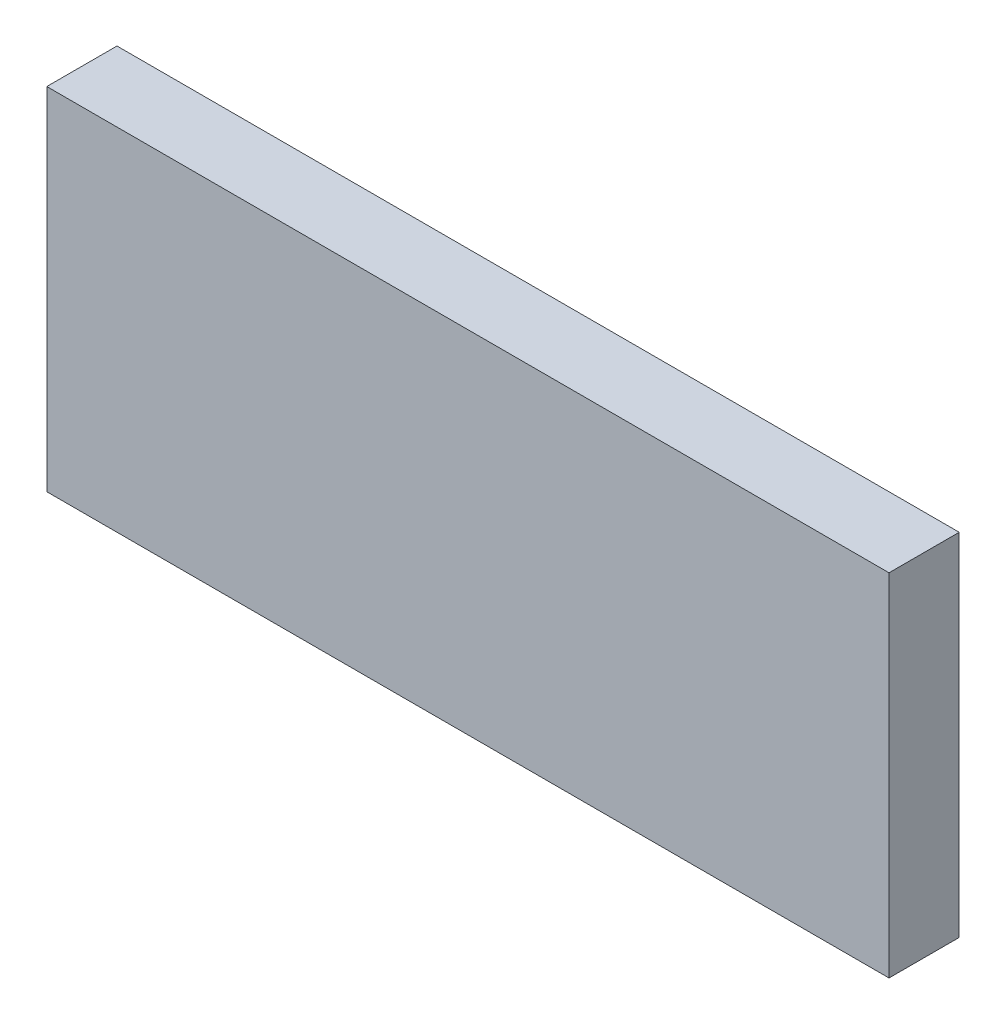
from build123d import *

# Parameters (mm, degrees)
SKETCH1_W           = 18
SKETCH1_H           = 7.5
BOSS_EXTRUDE1_DEPTH = 1.5
SCALE1_SCALE        = 10


with BuildPart() as part:
    # Sketch1 → Boss-Extrude1 (new body)
    with BuildSketch(Plane.XY):
        with Locations((9, 3.75)):
            Rectangle(SKETCH1_W, SKETCH1_H)
    extrude(amount=BOSS_EXTRUDE1_DEPTH)


with BuildPart() as part_1:
    # Scale1: scaled about (0, 0, 0)
    add(part.part.scale(SCALE1_SCALE))


solid = part_1.part
